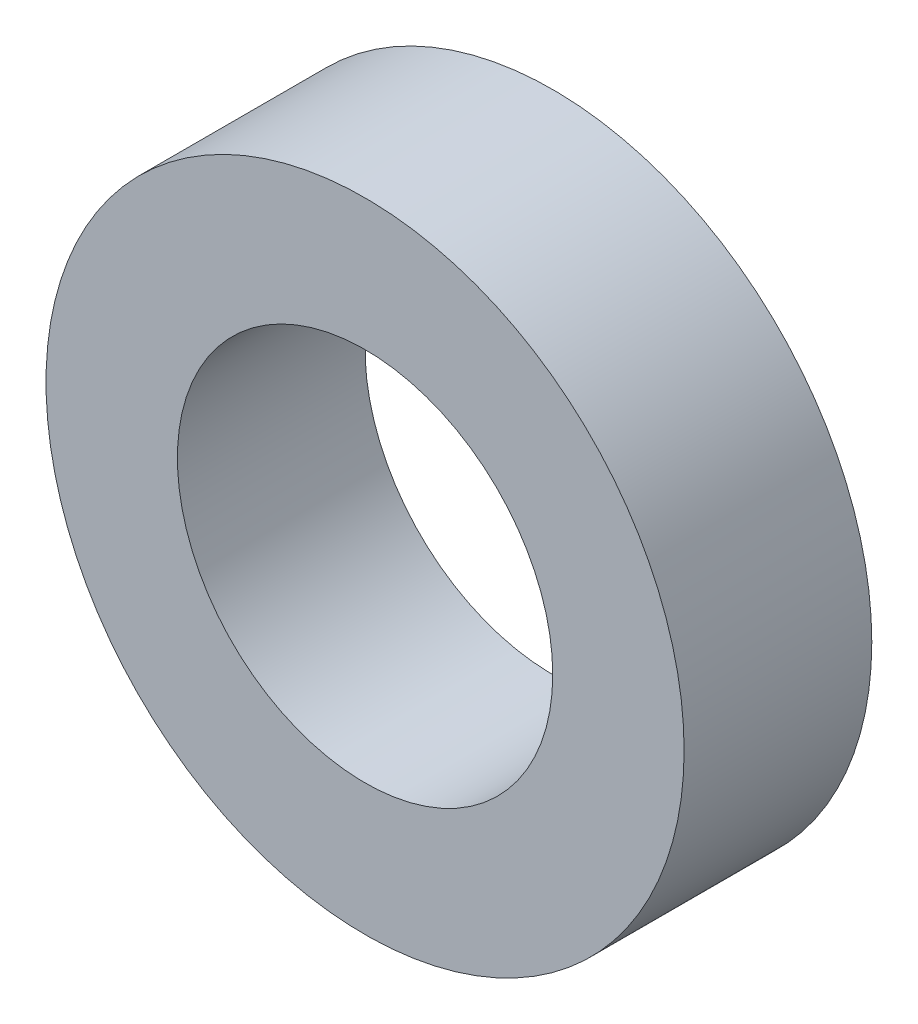
from build123d import *

# Parameters (mm, degrees)
SKETCH_1_R      = 8.5
SKETCH_1_R_2    = 5
EXTRUDE_1_DEPTH = 5


with BuildPart() as part:
    # 草图1 → 凸台-拉伸1 (new body)
    with BuildSketch(Plane.XY):
        Circle(SKETCH_1_R)
        Circle(SKETCH_1_R_2, mode=Mode.SUBTRACT)
    extrude(amount=EXTRUDE_1_DEPTH)


solid = part.part
